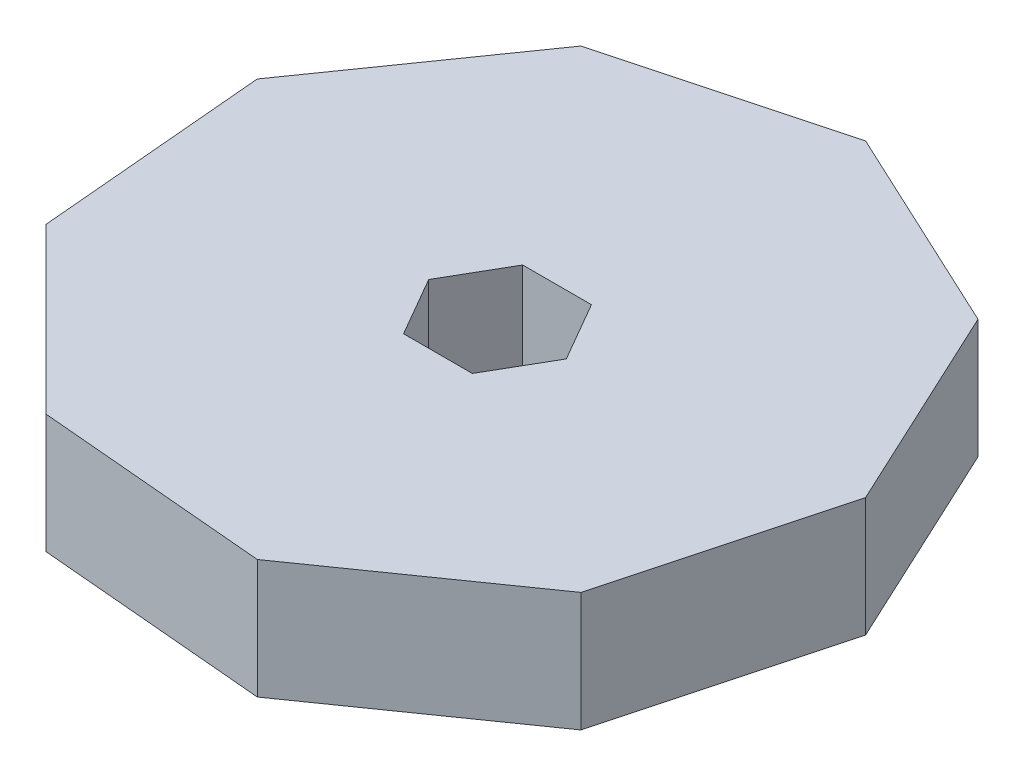
from build123d import *

# Parameters (mm, degrees)
BOSS_EXTRUDE1_DEPTH = 6.35
CUT_EXTRUDE1_DEPTH  = 6.35


with BuildPart() as part:
    # Sketch1 → Boss-Extrude1 (new body)
    with BuildSketch(Plane(origin=(0, 0, 0), x_dir=(1, 0, 0), z_dir=(0, 1, 0))):
        Polygon((14.834988784, -10.387570976), (18.04126264, 1.578405957), (12.8058292, 12.8058292), (1.578405957, 18.04126264), (-10.387570976, 14.834988784), (-17.493088004, 4.687258804), (-16.413394741, -7.653691664), (-7.653691664, -16.413394741), (4.687258804, -17.493088004), align=None)
    extrude(amount=BOSS_EXTRUDE1_DEPTH)

    # Sketch2 → Cut-Extrude1 (cut)
    with BuildSketch(Plane(origin=(0, 6.35, 0), x_dir=(1, 0, 0), z_dir=(0, 1, 0))):
        Polygon((1.833087105, 3.175), (-1.833087105, 3.175), (-3.666174209, 0), (-1.833087105, -3.175), (1.833087105, -3.175), (3.666174209, 0), align=None)
    extrude(amount=-CUT_EXTRUDE1_DEPTH, mode=Mode.SUBTRACT)


solid = part.part
